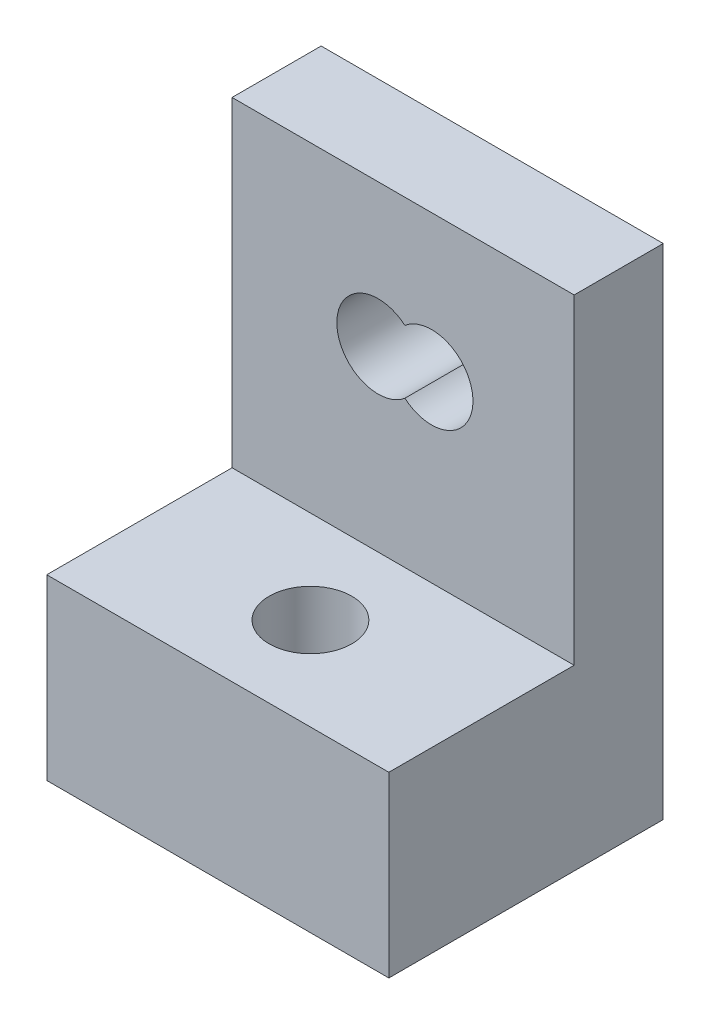
from build123d import *

# Parameters (mm, degrees)
SKETCH1_W           = 12.192
SKETCH1_H           = 9.779
BOSS_EXTRUDE1_DEPTH = 6.35
SKETCH2_W           = 12.192
SKETCH2_H           = 3.175
BOSS_EXTRUDE2_DEPTH = 11.43
SKETCH3_R           = 1.4732
CUT_EXTRUDE2_DEPTH  = 6.35
SKETCH4_R           = 1.4732
CUT_EXTRUDE3_DEPTH  = 6.35
SKETCH5_R           = 1.4732
CUT_EXTRUDE4_DEPTH  = 6.35


with BuildPart() as part:
    # Sketch1 → Boss-Extrude1 (new body)
    with BuildSketch(Plane(origin=(0, 0, 0), x_dir=(1, 0, 0), z_dir=(0, 1, 0))):
        with Locations((6.096, 4.8895)):
            Rectangle(SKETCH1_W, SKETCH1_H)
    extrude(amount=BOSS_EXTRUDE1_DEPTH)

    # Sketch2 → Boss-Extrude2 (add)
    with BuildSketch(Plane(origin=(0, 6.35, 0), x_dir=(1, 0, 0), z_dir=(0, 1, 0))):
        with Locations((6.096, 8.1915)):
            Rectangle(SKETCH2_W, SKETCH2_H)
    extrude(amount=BOSS_EXTRUDE2_DEPTH)

    # Sketch3 → Cut-Extrude2 (cut)
    with BuildSketch(Plane(origin=(0, 6.35, 0), x_dir=(1, 0, 0), z_dir=(0, 1, 0))):
        with Locations((25.4, 3.302)):
            Circle(SKETCH3_R)
        with Locations(Location((6.096, 3.302, 0), (0, 0, 270))):
            Circle(SKETCH3_R)
    extrude(amount=-CUT_EXTRUDE2_DEPTH, mode=Mode.SUBTRACT)

    # Sketch4 → Cut-Extrude3 (cut)
    with BuildSketch(Plane(origin=(0, 0, -9.779), x_dir=(-1, 0, 0), z_dir=(0, 0, -1))):
        with Locations((-5.207, 12.7)):
            Circle(SKETCH4_R)
    extrude(amount=-CUT_EXTRUDE3_DEPTH, mode=Mode.SUBTRACT)

    # Sketch5 → Cut-Extrude4 (cut)
    with BuildSketch(Plane(origin=(0, 0, -9.779), x_dir=(-1, 0, 0), z_dir=(0, 0, -1))):
        with Locations((-7.112, 12.7)):
            Circle(SKETCH5_R)
    extrude(amount=-CUT_EXTRUDE4_DEPTH, mode=Mode.SUBTRACT)


solid = part.part
